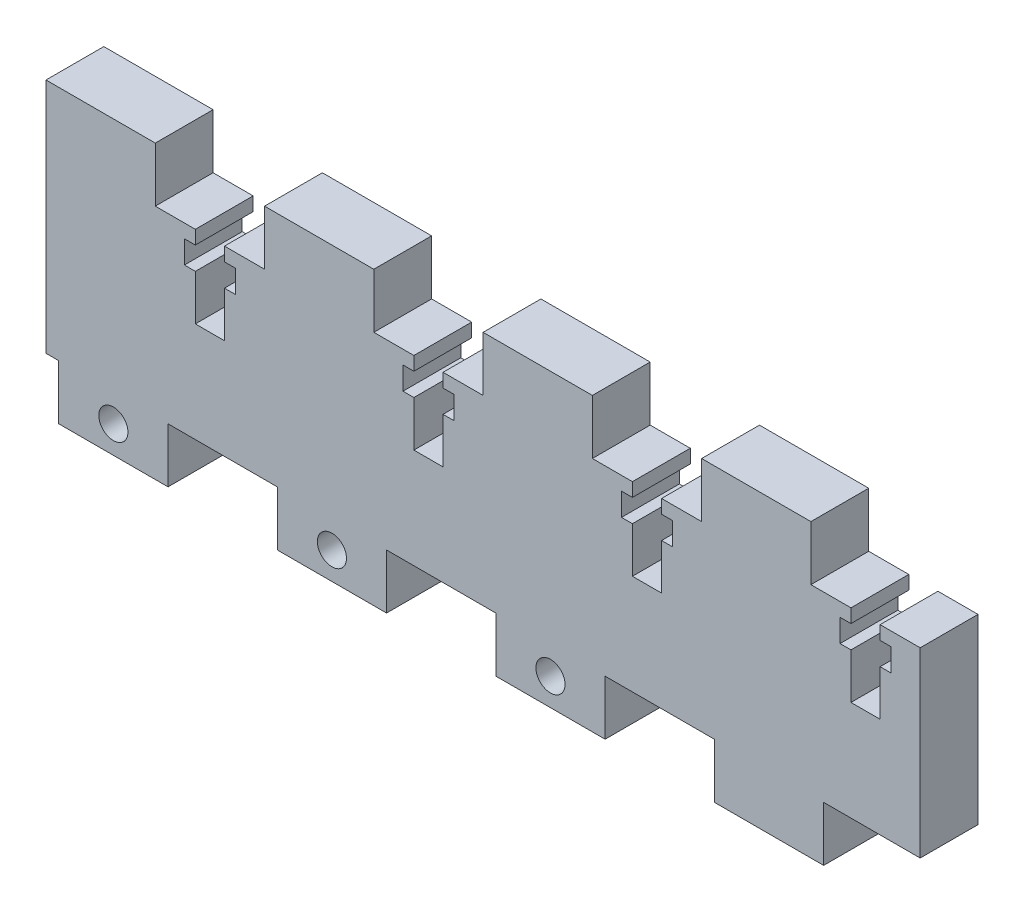
from build123d import *

# Parameters (mm, degrees)
SKETCH1_W           = 96
SKETCH1_H           = 20
BOSS_EXTRUDE1_DEPTH = 6.35
SKETCH2_W           = 12
SKETCH2_H           = 6
BOSS_EXTRUDE2_DEPTH = 6.35
LPATTERN2_COUNT     = 4
LPATTERN2_PITCH     = 24
CUT_EXTRUDE1_DEPTH  = 51.993357411
SKETCH6_W           = 12
SKETCH6_H           = 6
BOSS_EXTRUDE3_DEPTH = 6.35
LPATTERN3_COUNT     = 4
LPATTERN3_PITCH     = 24
SKETCH7_R           = 1.6
CUT_EXTRUDE3_DEPTH  = 51.993357411
LPATTERN4_COUNT     = 3
LPATTERN4_PITCH     = 24


with BuildPart() as part:
    # Sketch1 → Boss-Extrude1 (new body)
    with BuildSketch(Plane.XY):
        Rectangle(SKETCH1_W, SKETCH1_H)
    extrude(amount=BOSS_EXTRUDE1_DEPTH)

    # Sketch2 → Boss-Extrude2 (add)
    with BuildSketch(Plane.XY.offset(6.35)):
        with Locations((-42, 13)):
            Rectangle(SKETCH2_W, SKETCH2_H)
    boss_extrude2 = extrude(amount=-BOSS_EXTRUDE2_DEPTH)

    # LPattern2: Boss-Extrude2 ×4
    with Locations(*[(i * LPATTERN2_PITCH, 0, 0) for i in range(1, LPATTERN2_COUNT)]):
        add(boss_extrude2)

    # Sketch3 → Cut-Extrude1 (cut, through all)
    with BuildSketch(Plane.XY.offset(6.35)):
        Polygon((-31.6, 10), (-31.6, 8.5), (-32.8, 8.5), (-32.8, 6), (-31.6, 6), (-31.6, 1), (-28.4, 1), (-28.4, 6), (-27.2, 6), (-27.2, 8.5), (-28.4, 8.5), (-28.4, 10), align=None)
        Polygon((-7.6, 10), (-7.6, 8.5), (-8.8, 8.5), (-8.8, 6), (-7.6, 6), (-7.6, 1), (-4.4, 1), (-4.4, 6), (-3.2, 6), (-3.2, 8.5), (-4.4, 8.5), (-4.4, 10), align=None)
        Polygon((16.4, 10), (16.4, 8.5), (15.2, 8.5), (15.2, 6), (16.4, 6), (16.4, 1), (19.6, 1), (19.6, 6), (20.8, 6), (20.8, 8.5), (19.6, 8.5), (19.6, 10), align=None)
        Polygon((40.4, 10), (40.4, 8.5), (39.2, 8.5), (39.2, 6), (40.4, 6), (40.4, 1), (43.6, 1), (43.6, 6), (44.8, 6), (44.8, 8.5), (43.6, 8.5), (43.6, 10), align=None)
    extrude(amount=-CUT_EXTRUDE1_DEPTH, mode=Mode.SUBTRACT)

    # Sketch6 → Boss-Extrude3 (add)
    with BuildSketch(Plane.XY):
        with Locations((-40.6, -13)):
            Rectangle(SKETCH6_W, SKETCH6_H)
    boss_extrude3 = extrude(amount=BOSS_EXTRUDE3_DEPTH)

    # LPattern3: Boss-Extrude3 ×4
    with Locations(*[(i * LPATTERN3_PITCH, 0, 0) for i in range(1, LPATTERN3_COUNT)]):
        add(boss_extrude3)

    # Sketch7 → Cut-Extrude3 (cut, through all)
    with BuildSketch(Plane.XY.offset(6.35)):
        with Locations((-40.6, -13)):
            Circle(SKETCH7_R)
    cut_extrude3 = extrude(amount=-CUT_EXTRUDE3_DEPTH, mode=Mode.SUBTRACT)

    # LPattern4: Cut-Extrude3 ×3
    with Locations(*[(i * LPATTERN4_PITCH, 0, 0) for i in range(1, LPATTERN4_COUNT)]):
        add(cut_extrude3, mode=Mode.SUBTRACT)


solid = part.part
